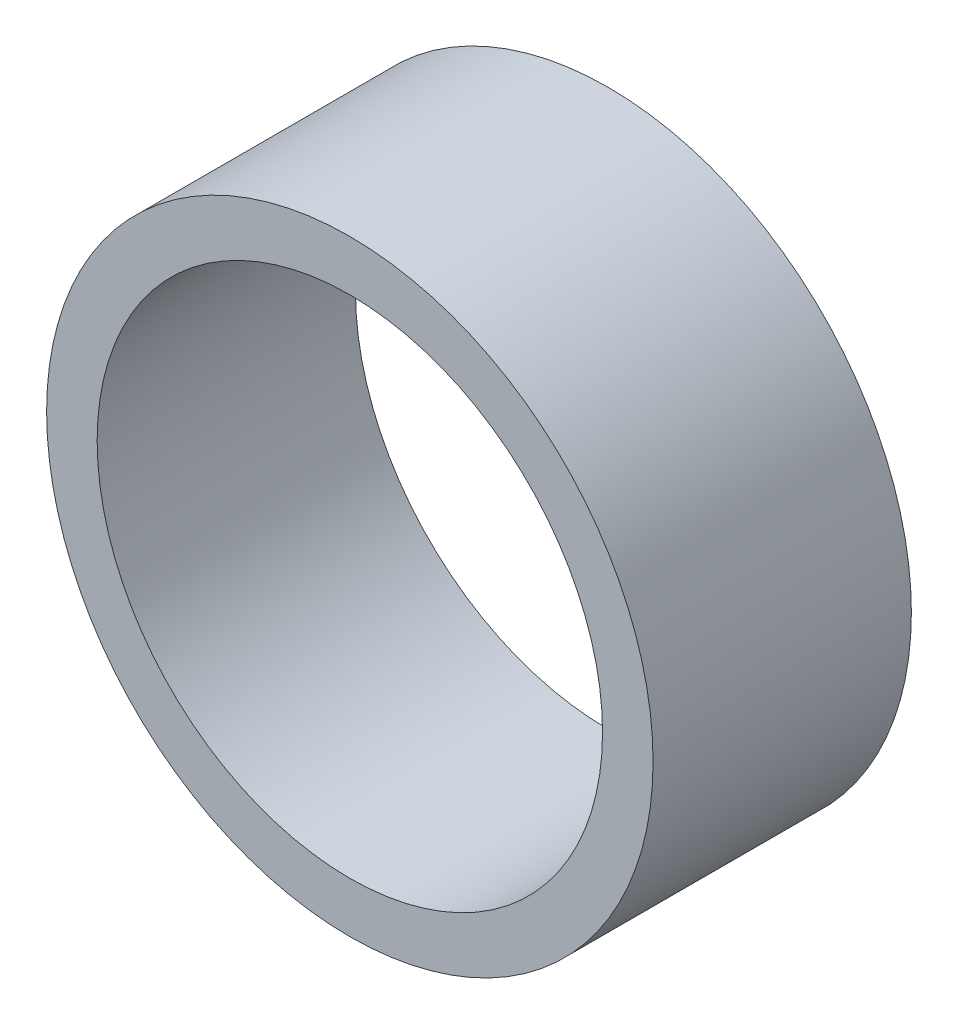
from build123d import *

# Parameters (mm, degrees)
ESBO_O1_R                = 27
ESBO_O1_R_2              = 22.5
RESSALTO_EXTRUS_O1_DEPTH = 23


with BuildPart() as part:
    # Esboço1 → Ressalto-extrusão1 (new body)
    with BuildSketch(Plane.XY):
        Circle(ESBO_O1_R)
        Circle(ESBO_O1_R_2, mode=Mode.SUBTRACT)
    extrude(amount=RESSALTO_EXTRUS_O1_DEPTH)


solid = part.part
